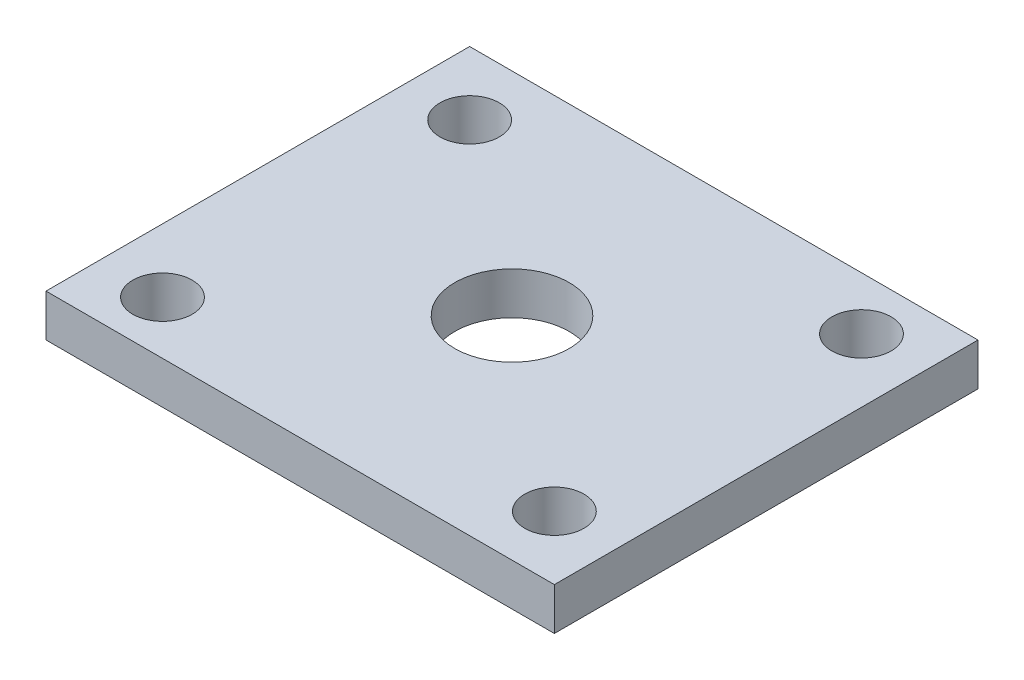
from build123d import *

# Parameters (mm, degrees)
SKETCH_1_W      = 12
SKETCH_1_H      = 10
SKETCH_1_R      = 1.35
SKETCH_1_R_2    = 0.7
EXTRUDE_1_DEPTH = 1


with BuildPart() as part:
    # 草图1 → 凸台-拉伸1 (new body)
    with BuildSketch(Plane(origin=(0, 0, 0), x_dir=(1, 0, 0), z_dir=(0, 1, 0))):
        Rectangle(SKETCH_1_W, SKETCH_1_H)
        with Locations(Location((0, 0, 0), (0, 0, 270))):
            Circle(SKETCH_1_R, mode=Mode.SUBTRACT)
        with Locations(Location((-4.5, 3.5, 0), (0, 0, 270))):
            Circle(SKETCH_1_R_2, mode=Mode.SUBTRACT)
        with Locations(Location((4.5, -3.5, 0), (0, 0, 270))):
            Circle(SKETCH_1_R_2, mode=Mode.SUBTRACT)
        with Locations(Location((4.5, 3.75, 0), (0, 0, 270))):
            Circle(SKETCH_1_R_2, mode=Mode.SUBTRACT)
        with Locations(Location((-4.5, -3.75, 0), (0, 0, 270))):
            Circle(SKETCH_1_R_2, mode=Mode.SUBTRACT)
    extrude(amount=EXTRUDE_1_DEPTH)


solid = part.part
